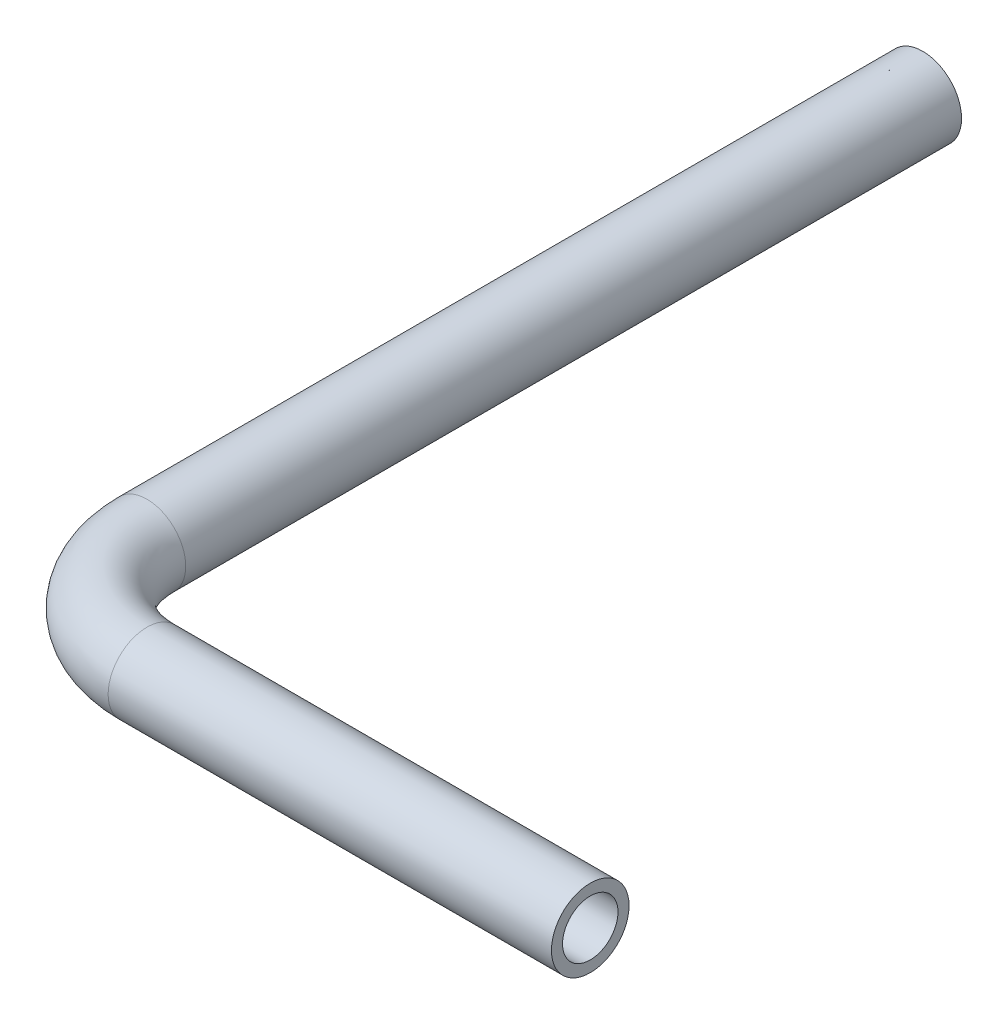
from build123d import *

# Parameters (mm, degrees)
SKETCH_1_R          = 17.5
SKETCH_1_R_2        = 12.5
CUT_EXTRUDE_3_REACH = 483.521
SKETCH_3_R          = 17.5
SKETCH_3_R_2        = 12.5


with BuildPart() as part:
    # 扫描1: sweep along a path in 草图2
    with BuildLine(Plane(origin=(0, 0, 0), x_dir=(1, 0, 0), z_dir=(0, 1, 0))) as sweep_1_path:
        Line((0, 0), (-450, 0))
        ThreePointArc((-450, 0), (-485.355339059, 14.644660941), (-500, 50))
        Line((-500, 50), (-500, 400))
    # 草图1 → 扫描1 (sweep)
    with BuildSketch(Plane(origin=(0, 0, 0), x_dir=(0, 0, -1), z_dir=(1, 0, 0))):
        Circle(SKETCH_1_R)
        Circle(SKETCH_1_R_2, mode=Mode.SUBTRACT)
    sweep(path=sweep_1_path.line)

    # 草图3 → 切除-拉伸3 (cut, up to next)
    with BuildSketch(Plane(origin=(-250, 0, 0), x_dir=(0, 0, -1), z_dir=(1, 0, 0)), mode=Mode.PRIVATE) as cut_extrude_3_sk1:
        with Locations(Location((0, 0, 0), (0, 0, 180))):
            Circle(SKETCH_3_R)
        with Locations(Location((0, 0, 0), (0, 0, 180))):
            Circle(SKETCH_3_R_2, mode=Mode.SUBTRACT)
    cut_extrude_3_tool1 = extrude(cut_extrude_3_sk1.sketch, amount=CUT_EXTRUDE_3_REACH, mode=Mode.PRIVATE) & part.part
    add(cut_extrude_3_tool1.solids().sort_by_distance((-250, 0, -17.005025))[0], mode=Mode.SUBTRACT)


solid = part.part
